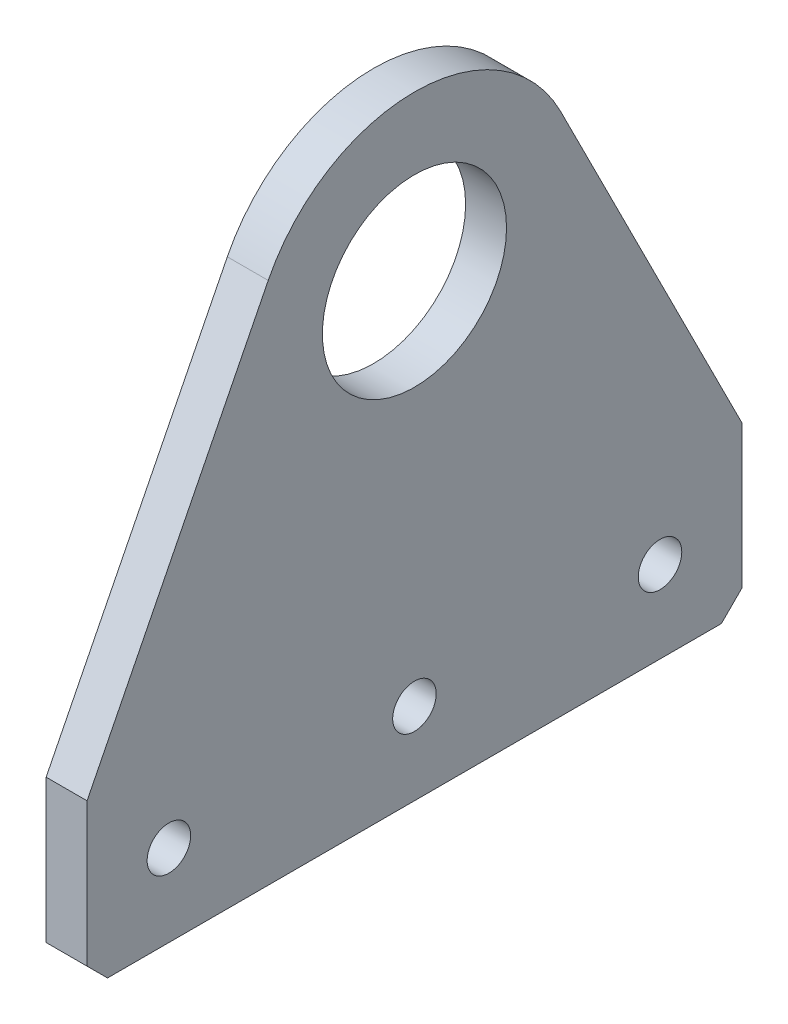
from build123d import *

# Parameters (mm, degrees)
SKETCH1_R           = 14.2875
BOSS_EXTRUDE1_DEPTH = 6.35
SKETCH2_R           = 3.3782
CUT_EXTRUDE1_DEPTH  = 140.411064841
CHAMFER1_SIZE       = 3.175


with BuildPart() as part:
    # Sketch1 → Boss-Extrude1 (new body)
    with BuildSketch(Plane(origin=(0, 0, 0), x_dir=(0, 0, -1), z_dir=(1, 0, 0))):
        with BuildLine():
            Line((0, 0), (0, 25.4))
            Line((0, 25.4), (28.110381264, 81.266707127))
            ThreePointArc((28.110381264, 81.266707127), (50.8, 95.25), (73.489618736, 81.266707127))
            Line((73.489618736, 81.266707127), (101.6, 25.4))
            Line((101.6, 25.4), (101.6, 0))
            Line((101.6, 0), (0, 0))
        make_face()
        with Locations((50.8, 69.85)):
            Circle(SKETCH1_R, mode=Mode.SUBTRACT)
    extrude(amount=BOSS_EXTRUDE1_DEPTH)

    # Sketch2 → Cut-Extrude1 (cut, through all)
    with BuildSketch(Plane(origin=(6.35, 0, 0), x_dir=(0, 0, -1), z_dir=(1, 0, 0))):
        with Locations((12.7, 12.7)):
            Circle(SKETCH2_R)
        with Locations((50.8, 12.7)):
            Circle(SKETCH2_R)
        with Locations((88.9, 12.7)):
            Circle(SKETCH2_R)
    extrude(amount=-CUT_EXTRUDE1_DEPTH, mode=Mode.SUBTRACT)

    # Chamfer1
    chamfer1_edges = [part.edges().sort_by_distance(p)[0] for p in [
        (3.175, 0, 0),
        (3.175, 0, -101.6),
    ]]
    chamfer(chamfer1_edges, length=CHAMFER1_SIZE)


solid = part.part
